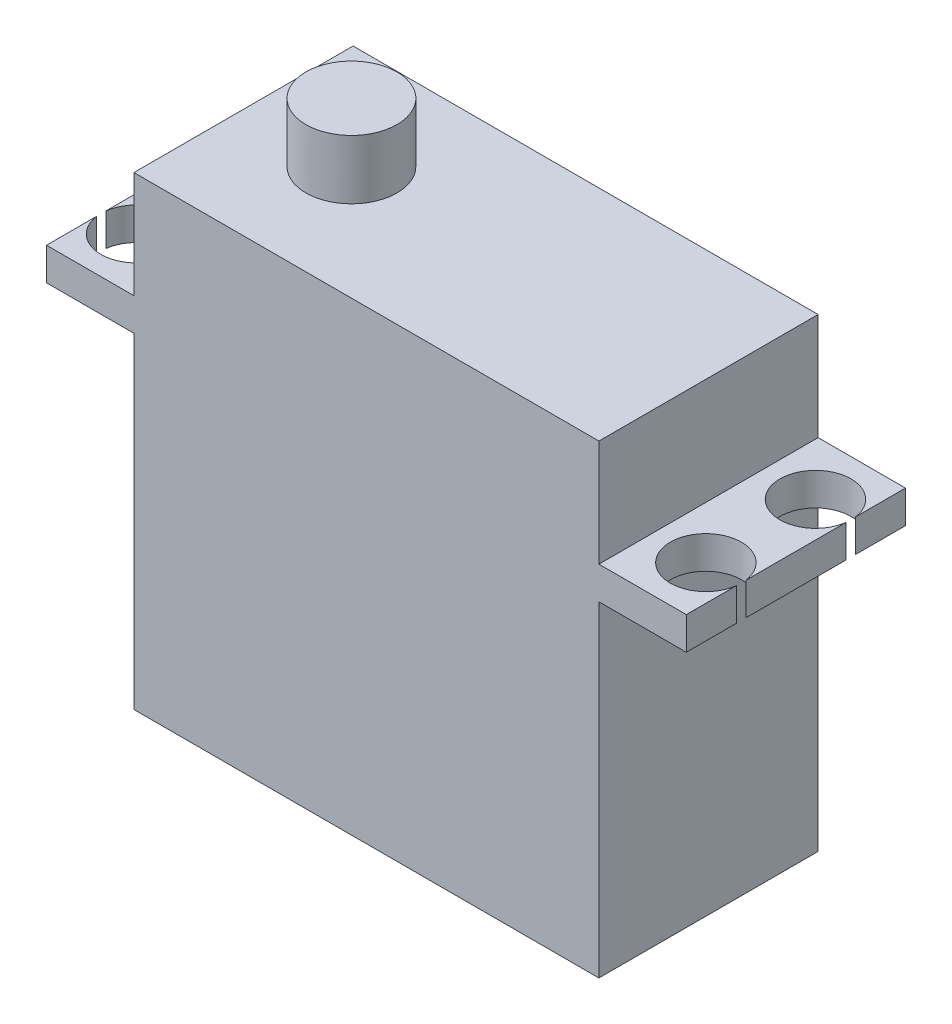
from build123d import *

# Parameters (mm, degrees)
SKETCH1_W           = 39.878
SKETCH1_H           = 18.796
BOSS_EXTRUDE1_DEPTH = 39.878
SKETCH2_W           = 18.796
SKETCH2_H           = 2.794
BOSS_EXTRUDE2_DEPTH = 7.493
SKETCH3_W           = 18.796
SKETCH3_H           = 2.794
BOSS_EXTRUDE3_DEPTH = 7.493
SKETCH6_R           = 3.908083023
BOSS_EXTRUDE5_DEPTH = 5.08
SKETCH7_R           = 3.048
CUT_EXTRUDE1_DEPTH  = 5.08


with BuildPart() as part:
    # Sketch1 → Boss-Extrude1 (new body)
    with BuildSketch(Plane(origin=(0, 0, 0), x_dir=(1, 0, 0), z_dir=(0, 1, 0))):
        with Locations((19.939, 9.398)):
            Rectangle(SKETCH1_W, SKETCH1_H)
    extrude(amount=BOSS_EXTRUDE1_DEPTH)

    # Sketch2 → Boss-Extrude2 (add)
    with BuildSketch(Plane.ZY):
        with Locations((-9.398, 29.337)):
            Rectangle(SKETCH2_W, SKETCH2_H)
    extrude(amount=BOSS_EXTRUDE2_DEPTH)

    # Sketch3 → Boss-Extrude3 (add)
    with BuildSketch(Plane(origin=(39.878, 0, 0), x_dir=(0, 0, -1), z_dir=(1, 0, 0))):
        with Locations((9.398, 29.337)):
            Rectangle(SKETCH3_W, SKETCH3_H)
    extrude(amount=BOSS_EXTRUDE3_DEPTH)

    # Sketch6 → Boss-Extrude5 (add)
    with BuildSketch(Plane(origin=(0, 39.878, 0), x_dir=(1, 0, 0), z_dir=(0, 1, 0))):
        with Locations(Location((8.89, 9.764757061, 0), (0, 0, 90))):
            Circle(SKETCH6_R)
    extrude(amount=BOSS_EXTRUDE5_DEPTH)

    # Sketch7 → Cut-Extrude1 (cut)
    with BuildSketch(Plane(origin=(0, 30.734, 0), x_dir=(1, 0, 0), z_dir=(0, 1, 0))):
        with Locations((-4.471485828, 14.097)):
            Circle(SKETCH7_R)
        with Locations((-4.471485828, 4.699)):
            Circle(SKETCH7_R)
        with Locations((44.349485828, 4.699)):
            Circle(SKETCH7_R)
        with Locations((44.349485828, 14.097)):
            Circle(SKETCH7_R)
    extrude(amount=-CUT_EXTRUDE1_DEPTH, mode=Mode.SUBTRACT)


solid = part.part
